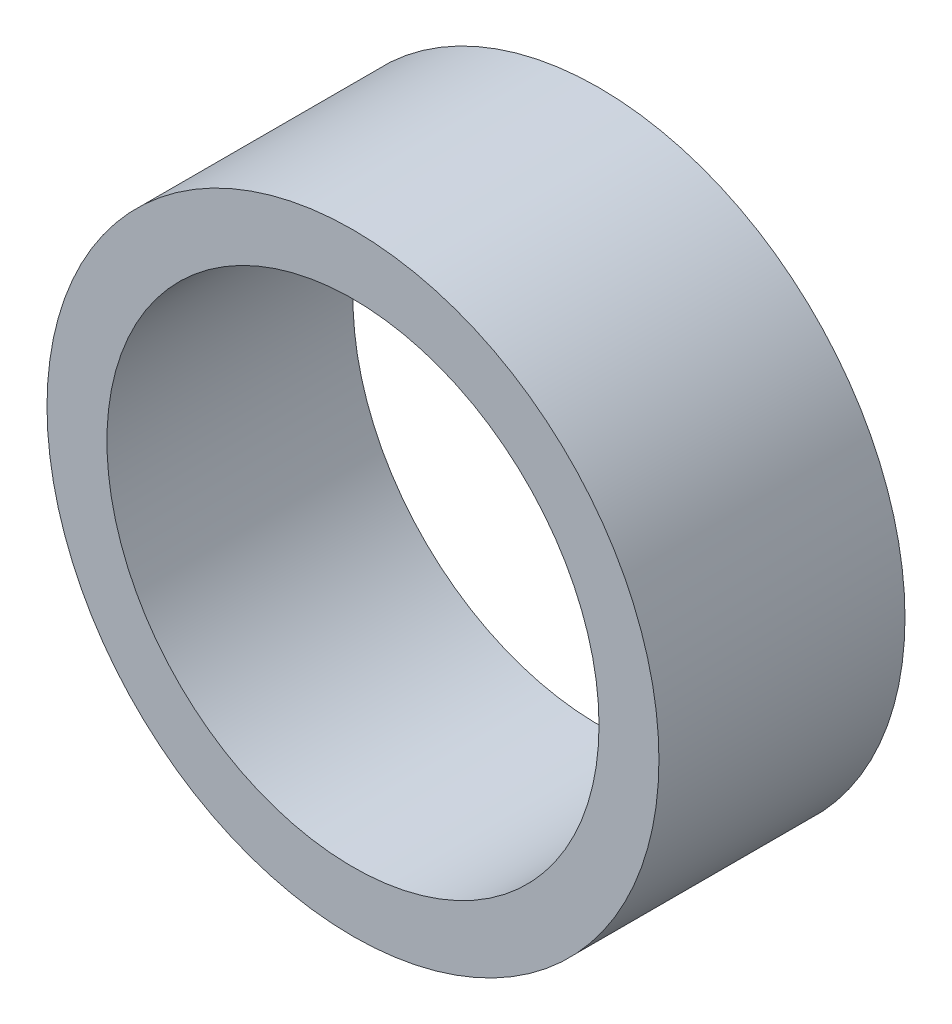
from build123d import *

# Parameters (mm, degrees)
SKETCH1_R           = 24.87
SKETCH1_R_2         = 20
BOSS_EXTRUDE1_DEPTH = 20


with BuildPart() as part:
    # Sketch1 → Boss-Extrude1 (new body)
    with BuildSketch(Plane.XY):
        Circle(SKETCH1_R)
        Circle(SKETCH1_R_2, mode=Mode.SUBTRACT)
    extrude(amount=BOSS_EXTRUDE1_DEPTH)


solid = part.part
